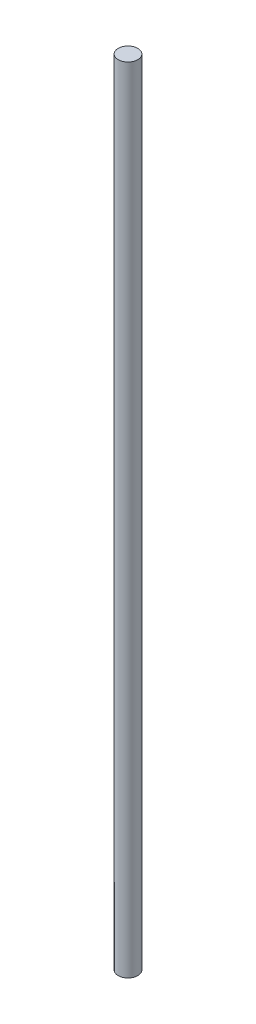
from build123d import *

# Parameters (mm, degrees)
ESBO_O1_R                = 4
RESSALTO_EXTRUS_O1_DEPTH = 323


with BuildPart() as part:
    # Esboço1 → Ressalto-extrusão1 (new body)
    with BuildSketch(Plane(origin=(0, 0, 0), x_dir=(1, 0, 0), z_dir=(0, 1, 0))):
        with Locations(Location((0, 0, 0), (0, 0, 270))):
            Circle(ESBO_O1_R)
    extrude(amount=RESSALTO_EXTRUS_O1_DEPTH)


solid = part.part
